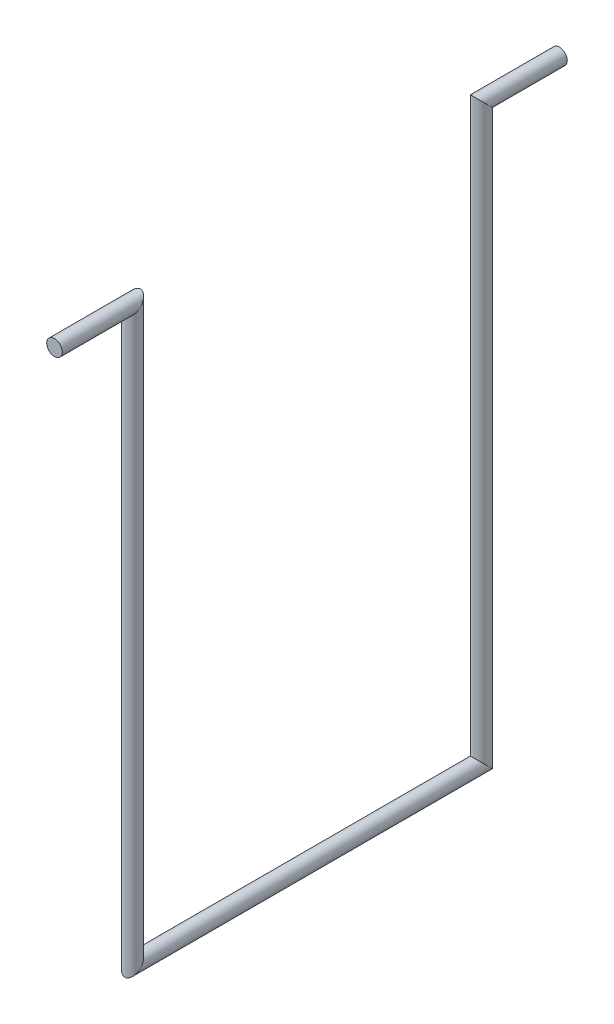
from build123d import *

# Parameters (mm, degrees)
SKETCH2_R = 0.75


with BuildPart() as part:
    # Sweep1: sweep along a path in Sketch1
    with BuildLine(Plane(origin=(0, 0, 0), x_dir=(0, 0, -1), z_dir=(1, 0, 0))) as sweep1_path:
        Line((41, 0), (33.5, 0))
        Line((33.5, 0), (33.5, -55))
        Line((33.5, -55), (0, -55))
        Line((0, -55), (0, 0))
        Line((0, 0), (-7.5, 0))
    # Sketch2 → Sweep1 (sweep)
    with BuildSketch(Plane.XY.offset(7.5)):
        Circle(SKETCH2_R)
    sweep(path=sweep1_path.line, transition=Transition.RIGHT)


solid = part.part
